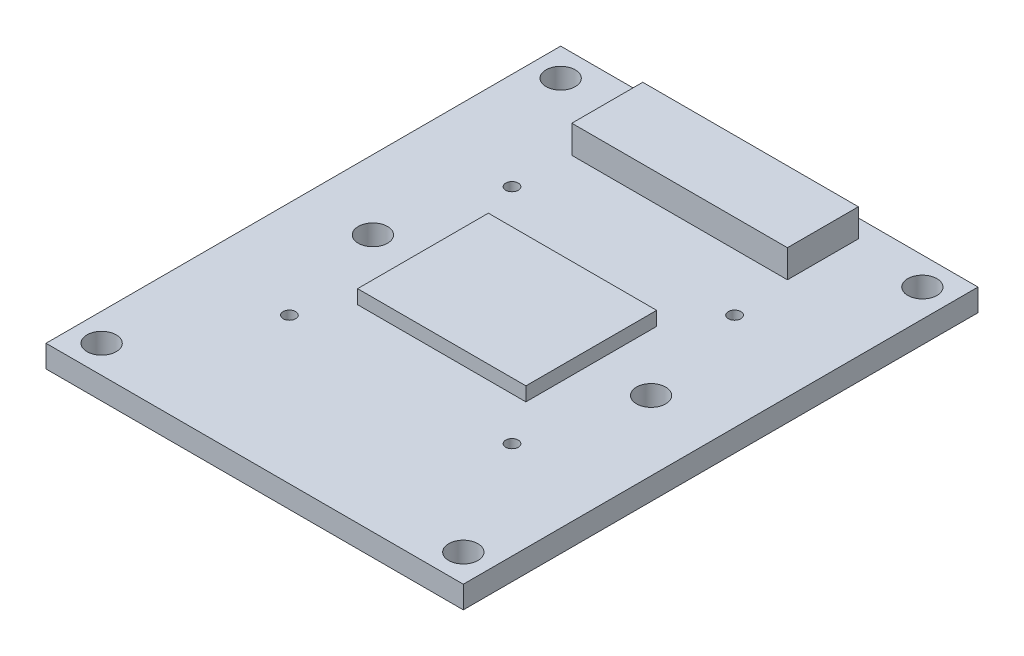
from build123d import *

# Parameters (mm, degrees)
SKETCH_1_W      = 30
SKETCH_1_H      = 37
SKETCH_1_R      = 1.05
SKETCH_1_R_2    = 0.45
EXTRUDE_1_DEPTH = 1.6
SKETCH_2_W      = 12.1
SKETCH_2_H      = 9.4
EXTRUDE_2_DEPTH = 1
SKETCH_3_W      = 15.5
SKETCH_3_H      = 5.1
EXTRUDE_3_DEPTH = 2


with BuildPart() as part:
    # 草图1 → 凸台-拉伸1 (new body)
    with BuildSketch(Plane(origin=(0, 0, 0), x_dir=(1, 0, 0), z_dir=(0, 1, 0))):
        with Locations((15, -18.5)):
            Rectangle(SKETCH_1_W, SKETCH_1_H)
        with Locations(Location((2, -2, 0), (0, 0, 270))):
            Circle(SKETCH_1_R, mode=Mode.SUBTRACT)
        with Locations(Location((28, -2, 0), (0, 0, 270))):
            Circle(SKETCH_1_R, mode=Mode.SUBTRACT)
        with Locations(Location((2, -35, 0), (0, 0, 270))):
            Circle(SKETCH_1_R, mode=Mode.SUBTRACT)
        with Locations(Location((28, -35, 0), (0, 0, 270))):
            Circle(SKETCH_1_R, mode=Mode.SUBTRACT)
        with Locations(Location((7, -10.5, 0), (0, 0, 270))):
            Circle(SKETCH_1_R_2, mode=Mode.SUBTRACT)
        with Locations(Location((23, -10.5, 0), (0, 0, 270))):
            Circle(SKETCH_1_R_2, mode=Mode.SUBTRACT)
        with Locations(Location((7, -26.5, 0), (0, 0, 270))):
            Circle(SKETCH_1_R_2, mode=Mode.SUBTRACT)
        with Locations(Location((23, -26.5, 0), (0, 0, 270))):
            Circle(SKETCH_1_R_2, mode=Mode.SUBTRACT)
        with Locations(Location((5, -18.5, 0), (0, 0, 270))):
            Circle(SKETCH_1_R, mode=Mode.SUBTRACT)
        with Locations(Location((25, -18.5, 0), (0, 0, 270))):
            Circle(SKETCH_1_R, mode=Mode.SUBTRACT)
    extrude(amount=EXTRUDE_1_DEPTH)

    # 草图2 → 凸台-拉伸2 (add)
    with BuildSketch(Plane(origin=(0, 1.6, 0), x_dir=(1, 0, 0), z_dir=(0, 1, 0))):
        with Locations((14.85, -18.7)):
            Rectangle(SKETCH_2_W, SKETCH_2_H)
    extrude(amount=EXTRUDE_2_DEPTH)

    # 草图3 → 凸台-拉伸3 (add)
    with BuildSketch(Plane(origin=(0, 1.6, 0), x_dir=(1, 0, 0), z_dir=(0, 1, 0))):
        with Locations((14.95, -3.85)):
            Rectangle(SKETCH_3_W, SKETCH_3_H)
    extrude(amount=EXTRUDE_3_DEPTH)


solid = part.part
